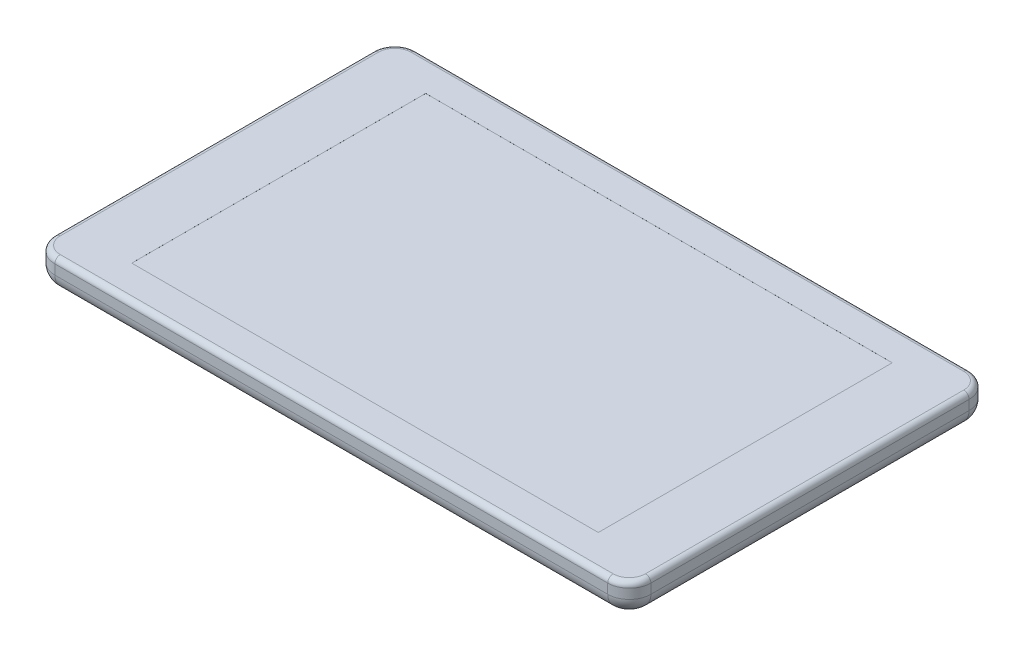
from build123d import *

# Parameters (mm, degrees)
SKETCH1_W           = 221
SKETCH1_H           = 134
BOSS_EXTRUDE1_DEPTH = 11.6
FILLET1_R           = 8
FILLET2_R           = 2
FILLET3_R           = 6
SKETCH2_W           = 173
SKETCH2_H           = 109
CUT_EXTRUDE1_DEPTH  = 0.01


with BuildPart() as part:
    # Sketch1 → Boss-Extrude1 (new body)
    with BuildSketch(Plane(origin=(0, 0, 0), x_dir=(1, 0, 0), z_dir=(0, 1, 0))):
        Rectangle(SKETCH1_W, SKETCH1_H)
    extrude(amount=BOSS_EXTRUDE1_DEPTH)

    # Fillet1
    fillet1_edges = [part.edges().sort_by_distance(p)[0] for p in [
        (-110.5, 5.8, -67),
        (110.5, 5.8, -67),
        (110.5, 5.8, 67),
        (-110.5, 5.8, 67),
    ]]
    fillet(fillet1_edges, radius=FILLET1_R)

    # Fillet2
    fillet2_edges = [part.edges().sort_by_distance(p)[0] for p in [
        (-110.5, 11.6, 0),
        (0, 11.6, -67),
        (0, 11.6, 67),
        (110.5, 11.6, 0),
        (-108.156854249, 11.6, 64.656854249),
        (108.156854249, 11.6, 64.656854249),
        (108.156854249, 11.6, -64.656854249),
        (-108.156854249, 11.6, -64.656854249),
    ]]
    fillet(fillet2_edges, radius=FILLET2_R)

    # Fillet3
    fillet3_edges = [part.edges().sort_by_distance(p)[0] for p in [
        (-110.5, 0, 0),
        (0, 0, -67),
        (110.5, 0, 0),
        (0, 0, 67),
        (-108.156854249, 0, 64.656854249),
        (108.156854249, 0, 64.656854249),
        (108.156854249, 0, -64.656854249),
        (-108.156854249, 0, -64.656854249),
    ]]
    fillet(fillet3_edges, radius=FILLET3_R)

    # Sketch2 → Cut-Extrude1 (cut)
    with BuildSketch(Plane(origin=(0, 11.6, 0), x_dir=(1, 0, 0), z_dir=(0, 1, 0))):
        Rectangle(SKETCH2_W, SKETCH2_H)
    extrude(amount=-CUT_EXTRUDE1_DEPTH, mode=Mode.SUBTRACT)


solid = part.part
